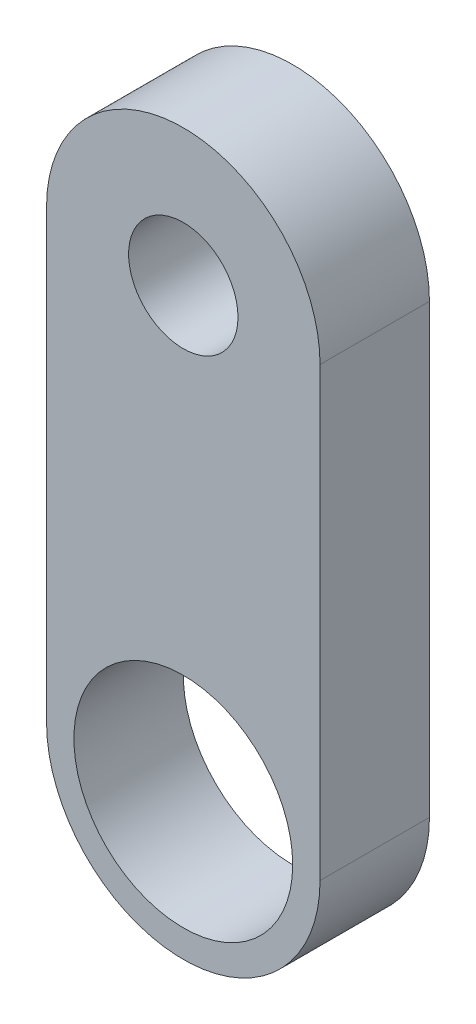
from build123d import *

# Parameters (mm, degrees)
SKETCH_1_R      = 1
SKETCH_1_R_2    = 2
EXTRUDE_1_DEPTH = 2


with BuildPart() as part:
    # 스케치1 → 보스-돌출1 (new body)
    with BuildSketch(Plane.XY):
        with BuildLine():
            Line((-2.5, 4.085), (-2.5, -4.085))
            ThreePointArc((-2.5, -4.085), (0, -6.585), (2.5, -4.085))
            Line((2.5, -4.085), (2.5, 4.085))
            ThreePointArc((2.5, 4.085), (0, 6.585), (-2.5, 4.085))
        make_face()
        with Locations((0, 4.085)):
            Circle(SKETCH_1_R, mode=Mode.SUBTRACT)
        with Locations((0, -4.085)):
            Circle(SKETCH_1_R_2, mode=Mode.SUBTRACT)
    extrude(amount=EXTRUDE_1_DEPTH)


solid = part.part
